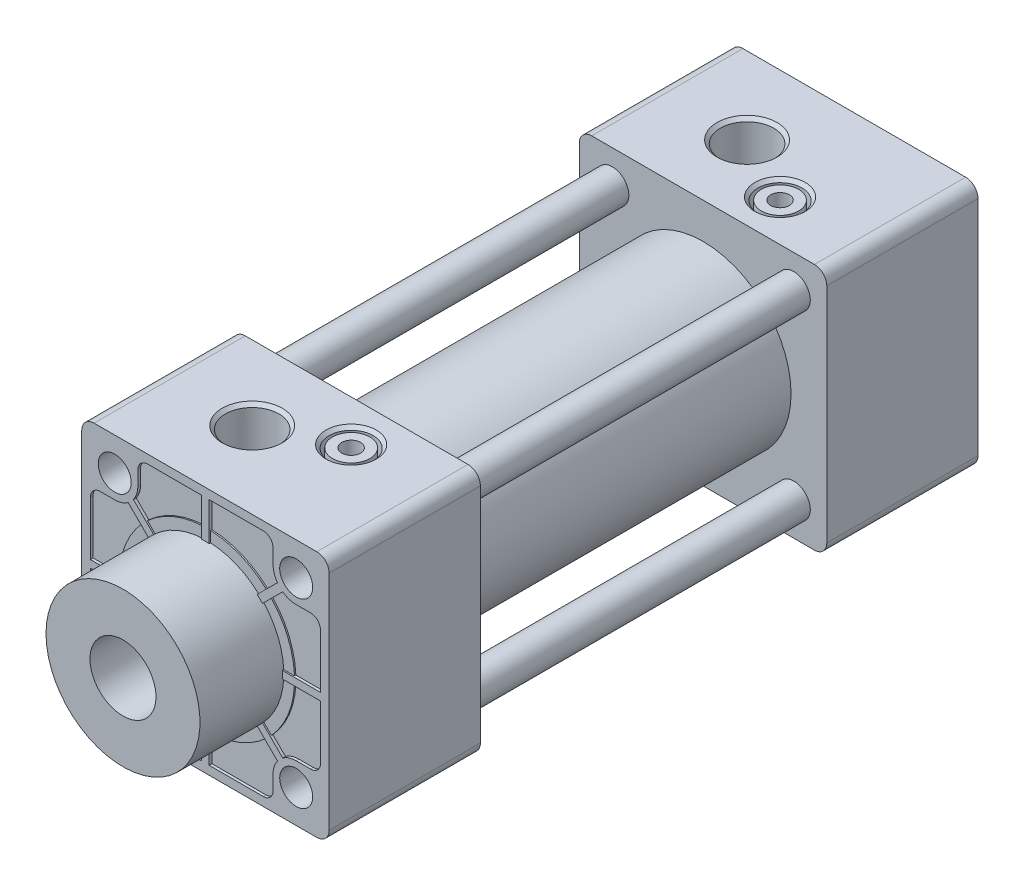
from build123d import *

# Parameters (mm, degrees)
EXTRUDE_START            = 59
EXTRUDE_1_DEPTH          = 118
CUT_EXTRUDE_START        = 31.5
SKETCH_4_R               = 16
CUT_EXTRUDE_1_DEPTH      = 63
CUT_EXTRUDE_10_DEPTH     = 0.5
SKETCH_18_W              = 1.35
SKETCH_18_H              = 22.5
EXTRUDE_7_DEPTH          = 0.5
SKETCH_20_R              = 15.96
EXTRUDE_8_DEPTH          = 0.25
PATTERN_CIRCULAR_3_COUNT = 8
SKETCH_21_W              = 1.35
SKETCH_21_H              = 22.5
EXTRUDE_9_DEPTH          = 0.5
EXTRUDE_START_2          = 0.5
SKETCH_22_R              = 15.96
EXTRUDE_10_DEPTH         = 0.5
PATTERN_CIRCULAR_4_COUNT = 8
SKETCH_5_W               = 15.5
SKETCH_5_H               = 14
SKETCH_6_R               = 3
EXTRUDE_2_DEPTH          = 63
PATTERN_CIRCULAR_1_COUNT = 4
SKETCH_7_R               = 4.8645
SKETCH_7_R_2             = 4
CUT_EXTRUDE_3_DEPTH      = 9
SKETCH_15_R              = 3.4
EXTRUDE_4_DEPTH          = 8.5
SKETCH_16_R              = 1.7
CUT_EXTRUDE_9_DEPTH      = 8
CUT_EXTRUDE_START_2      = -9.5
SKETCH_23_R              = 3
CUT_EXTRUDE_11_DEPTH     = 9.5
PATTERN_CIRCULAR_5_COUNT = 4
MIRROR_START             = -9.5
MIRROR_5_COPY_1_SKETCH_R = 3
MIRROR_5_COPY_1_DEPTH    = 9.5
MIRROR_5_COPY_2_SKETCH_R = 3
MIRROR_5_COPY_2_DEPTH    = 9.5
MIRROR_5_COPY_3_SKETCH_R = 3
MIRROR_5_COPY_3_DEPTH    = 9.5
SKETCH_24_R              = 6
CUT_EXTRUDE_12_DEPTH     = 105.5
CHAMFER_2_SIZE           = 0.59729
CHAMFER_3_SIZE           = 0.58
MOVE_BODY_1_ANGLE        = 90


with BuildPart() as part:
    # 草图3 → 凸台-拉伸1 (new body)
    with BuildSketch(Plane.XY.offset(EXTRUDE_START)):
        with BuildLine():
            Line((-22.5, -20.25), (-22.5, 20.25))
            ThreePointArc((-22.5, 20.25), (-21.840990258, 21.840990258), (-20.25, 22.5))
            Line((-20.25, 22.5), (20.25, 22.5))
            ThreePointArc((20.25, 22.5), (21.840990258, 21.840990258), (22.5, 20.25))
            Line((22.5, 20.25), (22.5, -20.25))
            ThreePointArc((22.5, -20.25), (21.840990258, -21.840990258), (20.25, -22.5))
            Line((20.25, -22.5), (-20.25, -22.5))
            ThreePointArc((-20.25, -22.5), (-21.840990258, -21.840990258), (-22.5, -20.25))
        make_face()
    extrude(amount=-EXTRUDE_1_DEPTH)

    # 草图4 → 切除-拉伸1 (cut)
    with BuildSketch(Plane.XY.offset(CUT_EXTRUDE_START)):
        with BuildLine():
            Line((-22.5, -20.25), (-22.5, 20.25))
            ThreePointArc((-22.5, 20.25), (-21.840990258, 21.840990258), (-20.25, 22.5))
            Line((-20.25, 22.5), (20.25, 22.5))
            ThreePointArc((20.25, 22.5), (21.840990258, 21.840990258), (22.5, 20.25))
            Line((22.5, 20.25), (22.5, -20.25))
            ThreePointArc((22.5, -20.25), (21.840990258, -21.840990258), (20.25, -22.5))
            Line((20.25, -22.5), (-20.25, -22.5))
            ThreePointArc((-20.25, -22.5), (-21.840990258, -21.840990258), (-22.5, -20.25))
        make_face()
        Circle(SKETCH_4_R, mode=Mode.SUBTRACT)
    extrude(amount=-CUT_EXTRUDE_1_DEPTH, mode=Mode.SUBTRACT)

    # 草图17 → 切除-拉伸10 (cut)
    with BuildSketch(Plane.XY.offset(59)):
        with BuildLine():
            Line((-10.5, -20.925), (10.5, -20.925))
            ThreePointArc((10.5, -20.925), (11.772792206, -20.397792206), (12.3, -19.125))
            Line((12.3, -19.125), (12.3, -16.5))
            ThreePointArc((12.3, -16.5), (13.530151519, -13.530151519), (16.5, -12.3))
            Line((16.5, -12.3), (19.125, -12.3))
            ThreePointArc((19.125, -12.3), (20.397792206, -11.772792206), (20.925, -10.5))
            Line((20.925, -10.5), (20.925, 10.5))
            ThreePointArc((20.925, 10.5), (20.397792206, 11.772792206), (19.125, 12.3))
            Line((19.125, 12.3), (16.5, 12.3))
            ThreePointArc((16.5, 12.3), (13.530151519, 13.530151519), (12.3, 16.5))
            Line((12.3, 16.5), (12.3, 19.125))
            ThreePointArc((12.3, 19.125), (11.772792206, 20.397792206), (10.5, 20.925))
            Line((10.5, 20.925), (-10.5, 20.925))
            ThreePointArc((-10.5, 20.925), (-11.772792206, 20.397792206), (-12.3, 19.125))
            Line((-12.3, 19.125), (-12.3, 16.5))
            ThreePointArc((-12.3, 16.5), (-13.530151519, 13.530151519), (-16.5, 12.3))
            Line((-16.5, 12.3), (-19.125, 12.3))
            ThreePointArc((-19.125, 12.3), (-20.397792206, 11.772792206), (-20.925, 10.5))
            Line((-20.925, 10.5), (-20.925, -10.5))
            ThreePointArc((-20.925, -10.5), (-20.397792206, -11.772792206), (-19.125, -12.3))
            Line((-19.125, -12.3), (-16.5, -12.3))
            ThreePointArc((-16.5, -12.3), (-13.530151519, -13.530151519), (-12.3, -16.5))
            Line((-12.3, -16.5), (-12.3, -19.125))
            ThreePointArc((-12.3, -19.125), (-11.772792206, -20.397792206), (-10.5, -20.925))
        make_face()
    cut_extrude_10 = extrude(amount=-CUT_EXTRUDE_10_DEPTH, mode=Mode.SUBTRACT)

    # 草图18 → 凸台-拉伸7 (add)
    with BuildSketch(Plane.XY.offset(58.5)):
        with Locations((0, 11.25)):
            Rectangle(SKETCH_18_W, SKETCH_18_H)
    extrude_7 = extrude(amount=EXTRUDE_7_DEPTH)

    # 草图20 → 凸台-拉伸8 (add)
    with BuildSketch(Plane.XY.offset(58.5)):
        Circle(SKETCH_20_R)
    extrude(amount=EXTRUDE_8_DEPTH)

    # 阵列(圆周)3: 凸台-拉伸7 ×8 about axis
    pattern_circular_3_axis = Axis((0, 0, 0), (0, 0, 1))
    for i in range(1, PATTERN_CIRCULAR_3_COUNT):
        add(extrude_7.rotate(pattern_circular_3_axis, i * 360 / PATTERN_CIRCULAR_3_COUNT))

    # 镜向3: 切除-拉伸10 across plane
    add(cut_extrude_10.mirror(Plane.XY), mode=Mode.SUBTRACT)

    # 草图21 → 凸台-拉伸9 (add)
    with BuildSketch(Plane(origin=(0, 0, -58.5), x_dir=(-1, 0, 0), z_dir=(0, 0, -1))):
        with Locations((0, 11.25)):
            Rectangle(SKETCH_21_W, SKETCH_21_H)
    extrude_9 = extrude(amount=EXTRUDE_9_DEPTH)

    # 草图22 → 凸台-拉伸10 (add)
    with BuildSketch(Plane(origin=(0, 0, -58.5), x_dir=(-1, 0, 0), z_dir=(0, 0, -1)).offset(EXTRUDE_START_2)):
        Circle(SKETCH_22_R)
    extrude(amount=-EXTRUDE_10_DEPTH)

    # 阵列(圆周)4: 凸台-拉伸9 ×8 about axis
    pattern_circular_4_axis = Axis((0, 0, 0), (0, 0, 1))
    for i in range(1, PATTERN_CIRCULAR_4_COUNT):
        add(extrude_9.rotate(pattern_circular_4_axis, i * 360 / PATTERN_CIRCULAR_4_COUNT))

    # 草图5 → 旋转2 (revolve)
    with BuildSketch(Plane(origin=(0, 0, 0), x_dir=(0, 0, -1), z_dir=(1, 0, 0))):
        with Locations((-66.25, 7)):
            Rectangle(SKETCH_5_W, SKETCH_5_H)
    revolve(axis=Axis((0, 0, 58.5), (0, 0, 1)))

    # 草图6 → 凸台-拉伸2 (add)
    with BuildSketch(Plane.XY.offset(-31.5)):
        with Locations((-16.5, 16.5)):
            Circle(SKETCH_6_R)
    extrude_2 = extrude(amount=EXTRUDE_2_DEPTH)

    # 阵列(圆周)1: 凸台-拉伸2 ×4 about axis
    pattern_circular_1_axis = Axis((0, 0, 0), (0, 0, 1))
    for i in range(1, PATTERN_CIRCULAR_1_COUNT):
        add(extrude_2.rotate(pattern_circular_1_axis, i * 360 / PATTERN_CIRCULAR_1_COUNT))

    # 草图7 → 切除-拉伸3 (cut)
    with BuildSketch(Plane(origin=(22.5, 0, 0), x_dir=(0, 0, -1), z_dir=(1, 0, 0))):
        with Locations((45, 5.5)):
            Circle(SKETCH_7_R)
        with Locations((39, -6.5)):
            Circle(SKETCH_7_R_2)
    cut_extrude_3 = extrude(amount=-CUT_EXTRUDE_3_DEPTH, mode=Mode.SUBTRACT)

    # 镜向1: 切除-拉伸3 across plane
    add(cut_extrude_3.mirror(Plane.XY), mode=Mode.SUBTRACT)

    # 草图15 → 凸台-拉伸4 (add)
    with BuildSketch(Plane(origin=(13.5, 0, 0), x_dir=(0, 0, -1), z_dir=(1, 0, 0))):
        with Locations((39, -6.5)):
            Circle(SKETCH_15_R)
    extrude_4 = extrude(amount=EXTRUDE_4_DEPTH)

    # 草图16 → 切除-拉伸9 (cut)
    with BuildSketch(Plane(origin=(22, 0, 0), x_dir=(0, 0, -1), z_dir=(1, 0, 0))):
        with Locations((39, -6.5)):
            Circle(SKETCH_16_R)
    cut_extrude_9 = extrude(amount=-CUT_EXTRUDE_9_DEPTH, mode=Mode.SUBTRACT)

    # 镜向2: 凸台-拉伸4, 切除-拉伸9 across plane
    add(extrude_4.mirror(Plane.XY))
    add(cut_extrude_9.mirror(Plane.XY), mode=Mode.SUBTRACT)

    # 草图23 → 切除-拉伸11 (cut)
    with BuildSketch(Plane.XY.offset(59).offset(CUT_EXTRUDE_START_2)):
        with Locations((-16.5, 16.5)):
            Circle(SKETCH_23_R)
    cut_extrude_11 = extrude(amount=CUT_EXTRUDE_11_DEPTH, mode=Mode.SUBTRACT)

    # 阵列(圆周)5: 切除-拉伸11 ×4 about axis
    pattern_circular_5_axis = Axis((0, 0, 0), (0, 0, 1))
    for i in range(1, PATTERN_CIRCULAR_5_COUNT):
        add(cut_extrude_11.rotate(pattern_circular_5_axis, i * 360 / PATTERN_CIRCULAR_5_COUNT), mode=Mode.SUBTRACT)

    # 镜向5: 切除-拉伸11 across plane
    add(cut_extrude_11.mirror(Plane.XY), mode=Mode.SUBTRACT)

    # 镜向5 copy 1 sketch → 镜向5 copy 1 (cut)
    with BuildSketch(Plane.YX.offset(59).offset(MIRROR_START)):
        with Locations((-16.5, -16.5)):
            Circle(MIRROR_5_COPY_1_SKETCH_R)
    extrude(amount=MIRROR_5_COPY_1_DEPTH, mode=Mode.SUBTRACT)

    # 镜向5 copy 2 sketch → 镜向5 copy 2 (cut)
    with BuildSketch(Plane(origin=(0, 0, -59), x_dir=(-1, 0, 0), z_dir=(0, 0, -1)).offset(MIRROR_START)):
        with Locations((-16.5, -16.5)):
            Circle(MIRROR_5_COPY_2_SKETCH_R)
    extrude(amount=MIRROR_5_COPY_2_DEPTH, mode=Mode.SUBTRACT)

    # 镜向5 copy 3 sketch → 镜向5 copy 3 (cut)
    with BuildSketch(Plane(origin=(0, 0, -59), x_dir=(0, -1, 0), z_dir=(0, 0, -1)).offset(MIRROR_START)):
        with Locations((-16.5, -16.5)):
            Circle(MIRROR_5_COPY_3_SKETCH_R)
    extrude(amount=MIRROR_5_COPY_3_DEPTH, mode=Mode.SUBTRACT)

    # 草图24 → 切除-拉伸12 (cut)
    with BuildSketch(Plane.XY.offset(74)):
        Circle(SKETCH_24_R)
    extrude(amount=-CUT_EXTRUDE_12_DEPTH, mode=Mode.SUBTRACT)

    # 倒角2
    chamfer_2_edges = [part.edges().sort_by_distance(p)[0] for p in [
        (22.5, 5.5, -40.1355),
        (22.5, 5.5, 40.1355),
    ]]
    chamfer(chamfer_2_edges, length=CHAMFER_2_SIZE)

    # 倒角3
    chamfer_3_edges = [part.edges().sort_by_distance(p)[0] for p in [
        (22.5, -6.5, -35),
        (22.5, -6.5, 35),
    ]]
    chamfer(chamfer_3_edges, length=CHAMFER_3_SIZE)


with BuildPart() as part_1:
    # Move Body 1: moved
    add(part.part.rotate(Axis((0, 0, 0), (0, 0, 1)), MOVE_BODY_1_ANGLE))


solid = part_1.part
